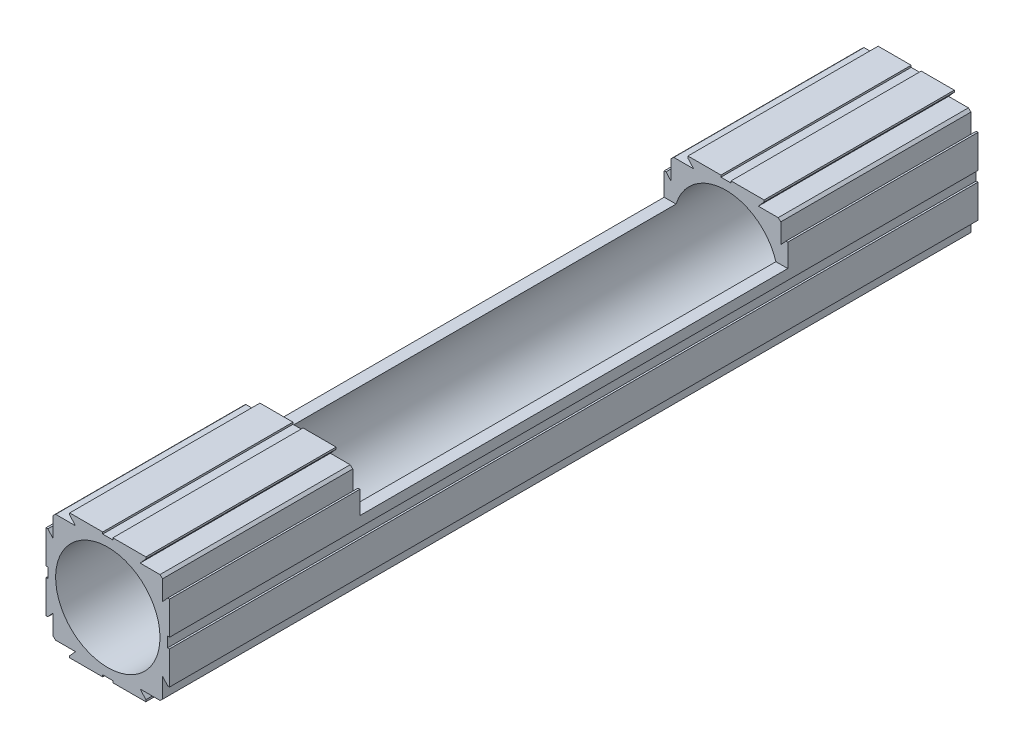
from build123d import *

# Parameters (mm, degrees)
SKETCH2_R               = 27.873868368
BOSS_EXTRUDE1_DEPTH     = 500
CUT_EXTRUDE1_DEPTH      = 505.976972678
CUT_EXTRUDE1_DEPTH_BACK = 505.976972678
SKETCH3_W               = 228.6
SKETCH3_H               = 25.4
SKETCH3_W_2             = 68.2
SKETCH3_H_2             = 67.058155704


with BuildPart() as part:
    # Sketch2 → Boss-Extrude1 (new body)
    with BuildSketch(Plane.XY):
        Polygon((-20.337957043, 33.529077852), (-2.699269284, 33.529077852), (-2.699269284, 32.535153464), (2.699269284, 32.535153464), (2.699269284, 33.529077852), (20.337957043, 33.529077852), (20.337957043, 32.535153464), (17.271526495, 29.113021938), (27.871192843, 29.113021938), (29.262123018, 27.866666927), (29.262123018, 17.267000578), (32.013880115, 20.337957043), (33.007804503, 20.337957043), (33.007804503, 2.699269284), (32.013880115, 2.699269284), (32.013880115, -2.699269284), (33.007804503, -2.699269284), (33.007804503, -20.337957043), (32.013880115, -20.337957043), (29.262123018, -17.267000578), (29.262123018, -27.866666927), (27.871192843, -29.113021938), (17.271526495, -29.113021938), (20.337957043, -32.535153464), (20.337957043, -33.529077852), (2.699269284, -33.529077852), (2.699269284, -32.535153464), (-2.699269284, -32.535153464), (-2.699269284, -33.529077852), (-20.337957043, -33.529077852), (-20.337957043, -32.535153464), (-17.271526495, -29.113021938), (-27.871192843, -29.113021938), (-29.262123018, -27.866666927), (-29.262123018, -17.267000578), (-32.013880115, -20.337957043), (-33.007804503, -20.337957043), (-33.007804503, -2.699269284), (-32.013880115, -2.699269284), (-32.013880115, 2.699269284), (-33.007804503, 2.699269284), (-33.007804503, 20.337957043), (-32.013880115, 20.337957043), (-29.262123018, 17.267000578), (-29.262123018, 27.866666927), (-27.871192843, 29.113021938), (-17.271526495, 29.113021938), (-20.337957043, 32.535153464), align=None)
        Circle(SKETCH2_R, mode=Mode.SUBTRACT)
    extrude(amount=BOSS_EXTRUDE1_DEPTH)

    # Sketch3 → Cut-Extrude1 (cut, two sides: drawn at the far end of the back side and taken through both)
    with BuildSketch(Plane(origin=(29.262123018, 0, 0), x_dir=(0, 0, -1), z_dir=(1, 0, 0)).offset(-CUT_EXTRUDE1_DEPTH_BACK)):
        with Locations((-284.1, 20.829077852)):
            Rectangle(SKETCH3_W, SKETCH3_H)
        with Locations((-34.1, 0)):
            Rectangle(SKETCH3_W_2, SKETCH3_H_2)
    extrude(amount=CUT_EXTRUDE1_DEPTH + CUT_EXTRUDE1_DEPTH_BACK, mode=Mode.SUBTRACT)


solid = part.part
